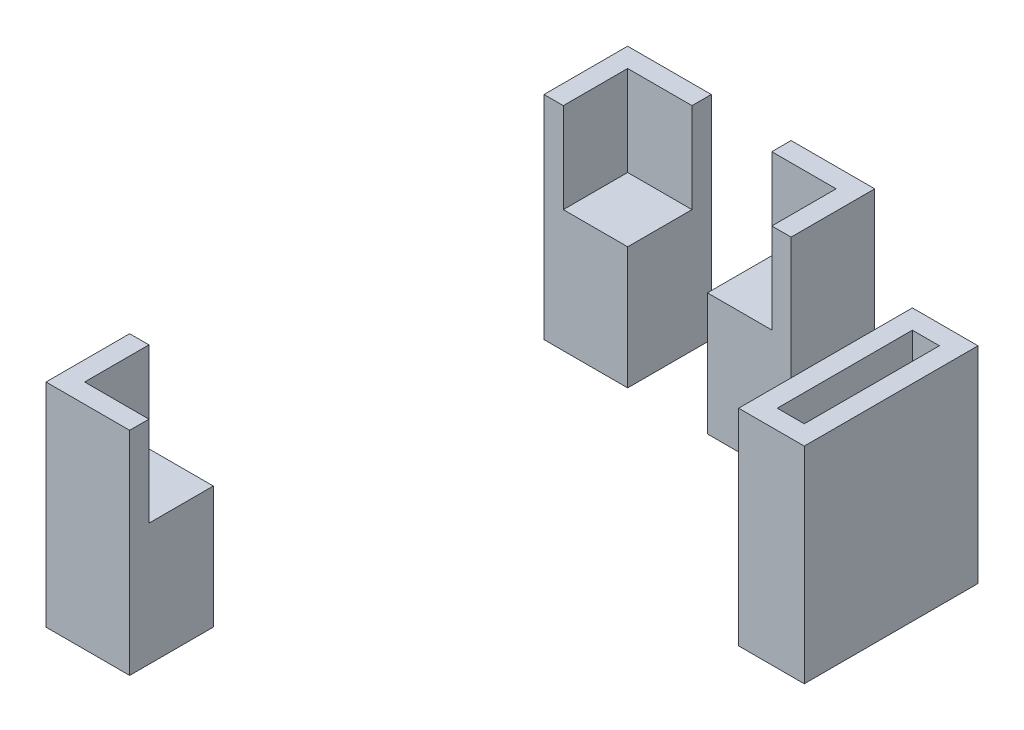
from build123d import *

# Parameters (mm, degrees)
BOSS_EXTRUDE3_DEPTH   = 16.5
BOSS_EXTRUDE3_2_DEPTH = 16.5
BOSS_EXTRUDE3_3_DEPTH = 16.5
SKETCH2_W             = 5.1
SKETCH2_H             = 13.5
SKETCH2_W_2           = 2.1
SKETCH2_H_2           = 10.5
BOSS_EXTRUDE3_4_DEPTH = 16.5
SKETCH2_W_3           = 2
SKETCH2_H_3           = 22
BOSS_EXTRUDE3_5_DEPTH = 16.5
SKETCH3_W             = 5
SKETCH3_H             = 5
BOSS_EXTRUDE4_DEPTH   = 9.5
SKETCH5_W             = 5.1
SKETCH5_H             = 13.5
CUT_EXTRUDE1_DEPTH    = 0.5
SKETCH4_W             = 2.1
SKETCH4_H             = 10.5
BOSS_EXTRUDE5_DEPTH   = 13
SKETCH6_W             = 2
SKETCH6_H             = 22
CUT_EXTRUDE2_DEPTH    = 70.899499283


with BuildPart() as part:
    # Sketch2 → Boss-Extrude3 (new body)
    with BuildSketch(Plane(origin=(0, 0, 0), x_dir=(1, 0, 0), z_dir=(0, 1, 0))):
        Polygon((0, 0), (0, -5), (-1.5, -5), (-1.5, 1.5), (5, 1.5), (5, 0), align=None)
    extrude(amount=BOSS_EXTRUDE3_DEPTH)



with BuildPart() as body_2:
    # Sketch2 → Boss-Extrude3 2 (new body)
    with BuildSketch(Plane(origin=(0, 0, 0), x_dir=(1, 0, 0), z_dir=(0, 1, 0))):
        Polygon((11.2, 0), (16.2, 0), (16.2, -5), (17.7, -5), (17.7, 1.5), (11.2, 1.5), align=None)
    extrude(amount=BOSS_EXTRUDE3_2_DEPTH)


with BuildPart() as body_3:
    # Sketch2 → Boss-Extrude3 3 (new body)
    with BuildSketch(Plane(origin=(0, 0, 0), x_dir=(1, 0, 0), z_dir=(0, 1, 0))):
        Polygon((0, -37.2), (0, -42.2), (5, -42.2), (5, -43.7), (-1.5, -43.7), (-1.5, -37.2), align=None)
    extrude(amount=BOSS_EXTRUDE3_3_DEPTH)


with BuildPart() as body_4:
    # Sketch2 → Boss-Extrude3 4 (new body)
    with BuildSketch(Plane(origin=(0, 0, 0), x_dir=(1, 0, 0), z_dir=(0, 1, 0))):
        with Locations((29.225, -11.3)):
            Rectangle(SKETCH2_W, SKETCH2_H)
        with Locations((29.225, -11.3)):
            Rectangle(SKETCH2_W_2, SKETCH2_H_2, mode=Mode.SUBTRACT)
    extrude(amount=BOSS_EXTRUDE3_4_DEPTH)

    # Sketch5 → Cut-Extrude1 (cut)
    with BuildSketch(Plane(origin=(0, 16.5, 0), x_dir=(1, 0, 0), z_dir=(0, 1, 0))):
        with Locations((29.225, -11.3)):
            Rectangle(SKETCH5_W, SKETCH5_H)
    extrude(amount=-CUT_EXTRUDE1_DEPTH, mode=Mode.SUBTRACT)

    # Sketch4 → Boss-Extrude5 (add)
    with BuildSketch(Plane(origin=(0, 0, 0), x_dir=(1, 0, 0), z_dir=(0, 1, 0))):
        with Locations((29.225, -11.3)):
            Rectangle(SKETCH4_W, SKETCH4_H)
    extrude(amount=BOSS_EXTRUDE5_DEPTH)


with BuildPart() as body_5:
    # Sketch2 → Boss-Extrude3 5 (new body)
    with BuildSketch(Plane(origin=(0, 0, 0), x_dir=(1, 0, 0), z_dir=(0, 1, 0))):
        with Locations((51, -32.7)):
            Rectangle(SKETCH2_W_3, SKETCH2_H_3)
    extrude(amount=BOSS_EXTRUDE3_5_DEPTH)

    # Sketch6 → Cut-Extrude2 (cut, through all)
    with BuildSketch(Plane(origin=(0, 16.5, 0), x_dir=(1, 0, 0), z_dir=(0, 1, 0))):
        with Locations((51, -32.7)):
            Rectangle(SKETCH6_W, SKETCH6_H)
    extrude(amount=-CUT_EXTRUDE2_DEPTH, mode=Mode.SUBTRACT)


with BuildPart() as part_1:
    add(part.part)

    add(body_2.part)  # Boss-Extrude4 merges body 2

    add(body_3.part)  # Boss-Extrude4 merges body 3
    # Sketch3 → Boss-Extrude4 (add)
    with BuildSketch(Plane(origin=(0, 0, 0), x_dir=(1, 0, 0), z_dir=(0, 1, 0))):
        with Locations((2.5, -2.5)):
            Rectangle(SKETCH3_W, SKETCH3_H)
        with Locations((13.7, -2.5)):
            Rectangle(SKETCH3_W, SKETCH3_H)
        with Locations((2.5, -39.7)):
            Rectangle(SKETCH3_W, SKETCH3_H)
    extrude(amount=BOSS_EXTRUDE4_DEPTH)


solid = Compound([body_4.part, part_1.part])
